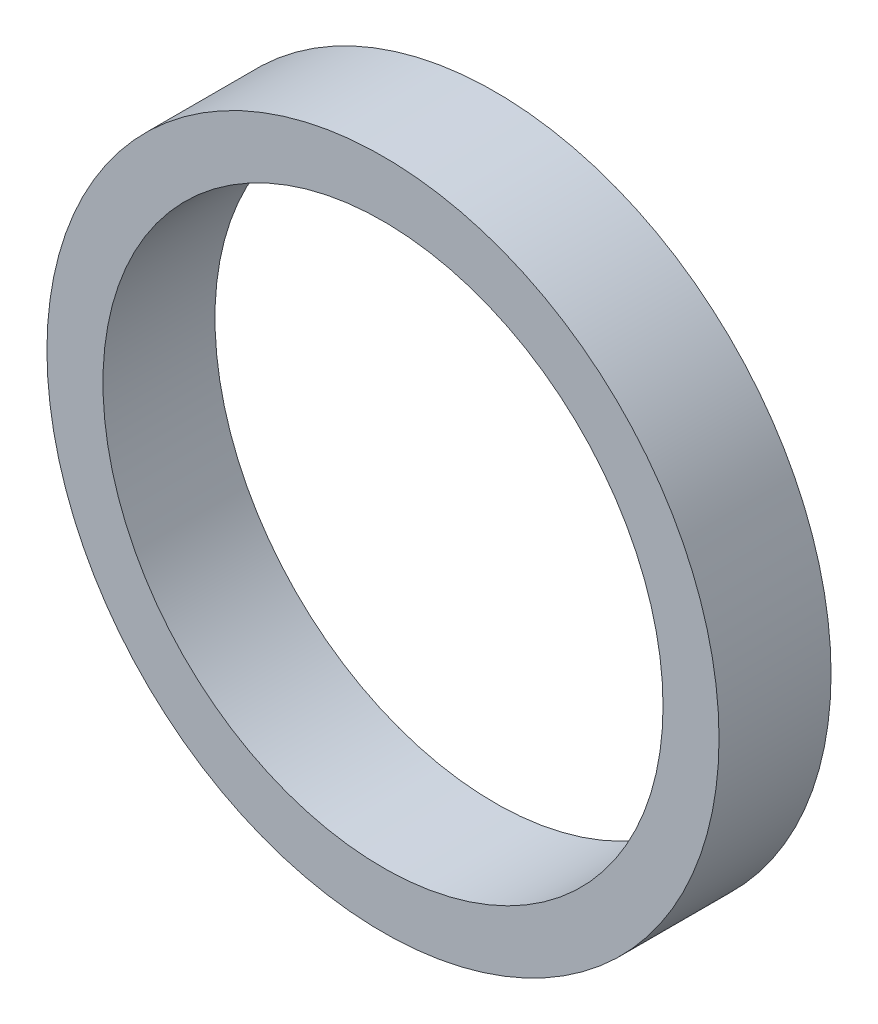
from build123d import *

# Parameters (mm, degrees)
SKETCH_1_R      = 6
SKETCH_1_R_2    = 5
EXTRUDE_1_DEPTH = 2


with BuildPart() as part:
    # 草图1 → 凸台-拉伸1 (new body)
    with BuildSketch(Plane.XY):
        Circle(SKETCH_1_R)
        Circle(SKETCH_1_R_2, mode=Mode.SUBTRACT)
    extrude(amount=EXTRUDE_1_DEPTH)


solid = part.part
